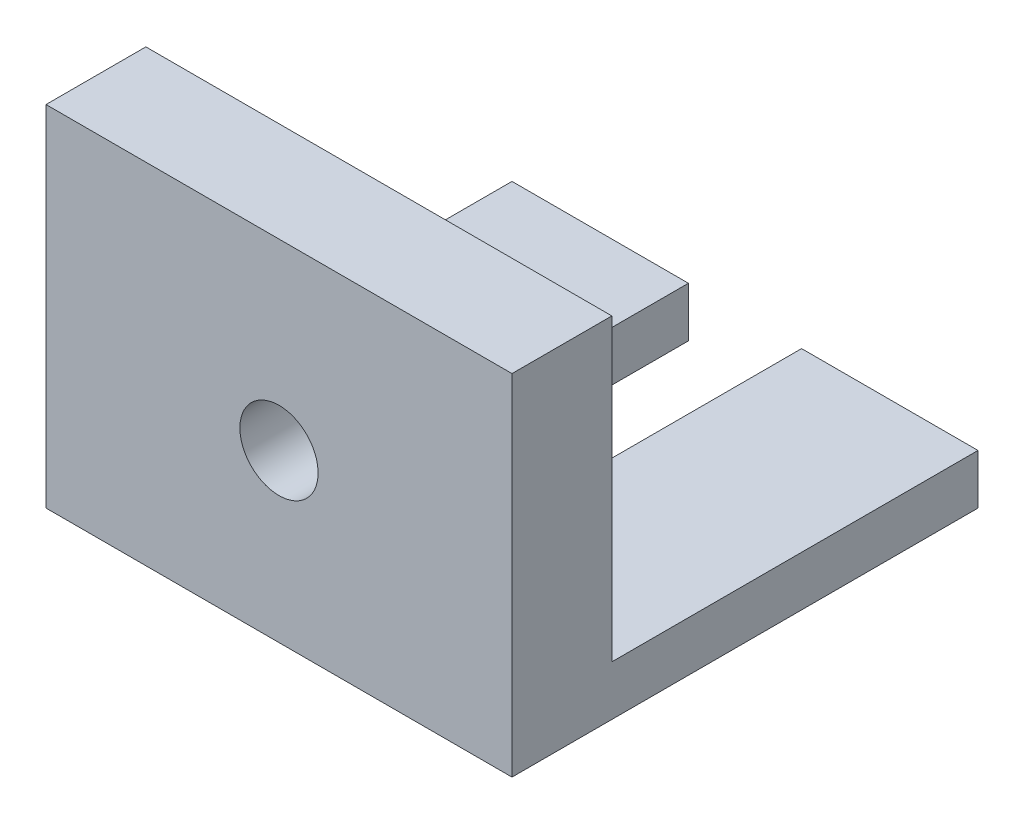
from build123d import *

# Parameters (mm, degrees)
SKETCH1_W           = 28
SKETCH1_H           = 28
BOSS_EXTRUDE1_DEPTH = 25
SKETCH2_W           = 28
SKETCH2_H           = 22
CUT_EXTRUDE1_DEPTH  = 22
SKETCH3_W           = 6.8
SKETCH3_H           = 22
CUT_EXTRUDE2_DEPTH  = 46.299006612
SKETCH4_R           = 2.35
CUT_EXTRUDE3_DEPTH  = 44.508619836
SKETCH5_W           = 28
SKETCH5_H           = 6
CUT_EXTRUDE4_DEPTH  = 4


with BuildPart() as part:
    # Sketch1 → Boss-Extrude1 (new body)
    with BuildSketch(Plane(origin=(0, 0, 0), x_dir=(1, 0, 0), z_dir=(0, 1, 0))):
        with Locations((14, -14)):
            Rectangle(SKETCH1_W, SKETCH1_H)
    extrude(amount=BOSS_EXTRUDE1_DEPTH)

    # Sketch2 → Cut-Extrude1 (cut)
    with BuildSketch(Plane(origin=(0, 25, 0), x_dir=(1, 0, 0), z_dir=(0, 1, 0))):
        with Locations((14, -11)):
            Rectangle(SKETCH2_W, SKETCH2_H)
    extrude(amount=-CUT_EXTRUDE1_DEPTH, mode=Mode.SUBTRACT)

    # Sketch3 → Cut-Extrude2 (cut, through all)
    with BuildSketch(Plane(origin=(0, 3, 0), x_dir=(1, 0, 0), z_dir=(0, 1, 0))):
        with Locations((14, -11)):
            Rectangle(SKETCH3_W, SKETCH3_H)
    extrude(amount=-CUT_EXTRUDE2_DEPTH, mode=Mode.SUBTRACT)

    # Sketch4 → Cut-Extrude3 (cut, through all)
    with BuildSketch(Plane(origin=(0, 0, 22), x_dir=(-1, 0, 0), z_dir=(0, 0, -1))):
        with Locations((-14, 10)):
            Circle(SKETCH4_R)
    extrude(amount=-CUT_EXTRUDE3_DEPTH, mode=Mode.SUBTRACT)

    # Sketch5 → Cut-Extrude4 (cut)
    with BuildSketch(Plane(origin=(0, 25, 0), x_dir=(1, 0, 0), z_dir=(0, 1, 0))):
        with Locations((14, -25)):
            Rectangle(SKETCH5_W, SKETCH5_H)
    extrude(amount=-CUT_EXTRUDE4_DEPTH, mode=Mode.SUBTRACT)


solid = part.part
